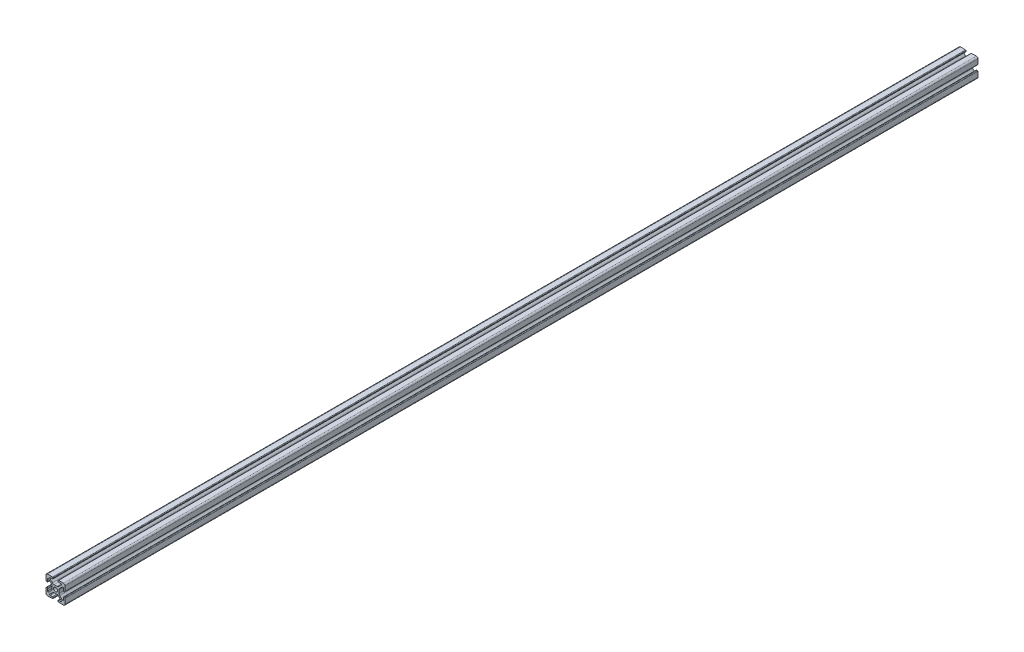
from build123d import *

# Parameters (mm, degrees)
BOSS_EXTRUDE1_DEPTH = 609.6
CIRPATTERN1_COUNT   = 4


with BuildPart() as part:
    # Sketch3 → Boss-Extrude1 (new, symmetric)
    with BuildSketch(Plane.XY):
        with BuildLine():
            Line((0, 4.7625), (-1.884807374, 4.7625))
            ThreePointArc((-1.884807374, 4.7625), (-3.099827272, 5.004182484), (-4.129871405, 5.69243597))
            Line((-4.129871405, 5.69243597), (-7.599623114, 9.162187679))
            ThreePointArc((-7.599623114, 9.162187679), (-7.759888701, 10.006330839), (-7.033220609, 10.464824259))
            Line((-7.033220609, 10.464824259), (-4.047481702, 10.360559959))
            ThreePointArc((-4.047481702, 10.360559959), (-3.501205536, 10.564804249), (-3.259352476, 11.095502353))
            Line((-3.259352476, 11.095502353), (-3.23896419, 11.679346474))
            ThreePointArc((-3.23896419, 11.679346474), (-3.443208479, 12.225622641), (-3.973906584, 12.467475701))
            Line((-3.973906584, 12.467475701), (-10.597084223, 12.698762161))
            ThreePointArc((-10.597084223, 12.698762161), (-12.104840979, 12.104840979), (-12.698762161, 10.597084223))
            Line((-12.698762161, 10.597084223), (-12.467475701, 3.973906584))
            ThreePointArc((-12.467475701, 3.973906584), (-12.225622641, 3.443208479), (-11.679346474, 3.23896419))
            Line((-11.679346474, 3.23896419), (-11.095502353, 3.259352476))
            ThreePointArc((-11.095502353, 3.259352476), (-10.564804249, 3.501205536), (-10.360559959, 4.047481702))
            Line((-10.360559959, 4.047481702), (-10.464824259, 7.033220609))
            ThreePointArc((-10.464824259, 7.033220609), (-10.006330839, 7.759888701), (-9.162187679, 7.599623114))
            Line((-9.162187679, 7.599623114), (-5.69243597, 4.129871405))
            ThreePointArc((-5.69243597, 4.129871405), (-5.004182484, 3.099827272), (-4.7625, 1.884807374))
            Line((-4.7625, 1.884807374), (-4.7625, 0))
            Line((-4.7625, 0), (-2.54, 0))
            ThreePointArc((-2.54, 0), (-1.796051224, 1.796051224), (0, 2.54))
            Line((0, 2.54), (0, 4.7625))
        make_face()
    boss_extrude1 = extrude(amount=BOSS_EXTRUDE1_DEPTH, both=True)

    # CirPattern1: Boss-Extrude1 ×4 about axis
    cirpattern1_axis = Axis((0, 0, 0), (0, 0, 1))
    for i in range(1, CIRPATTERN1_COUNT):
        add(boss_extrude1.rotate(cirpattern1_axis, i * 360 / CIRPATTERN1_COUNT))


solid = part.part
